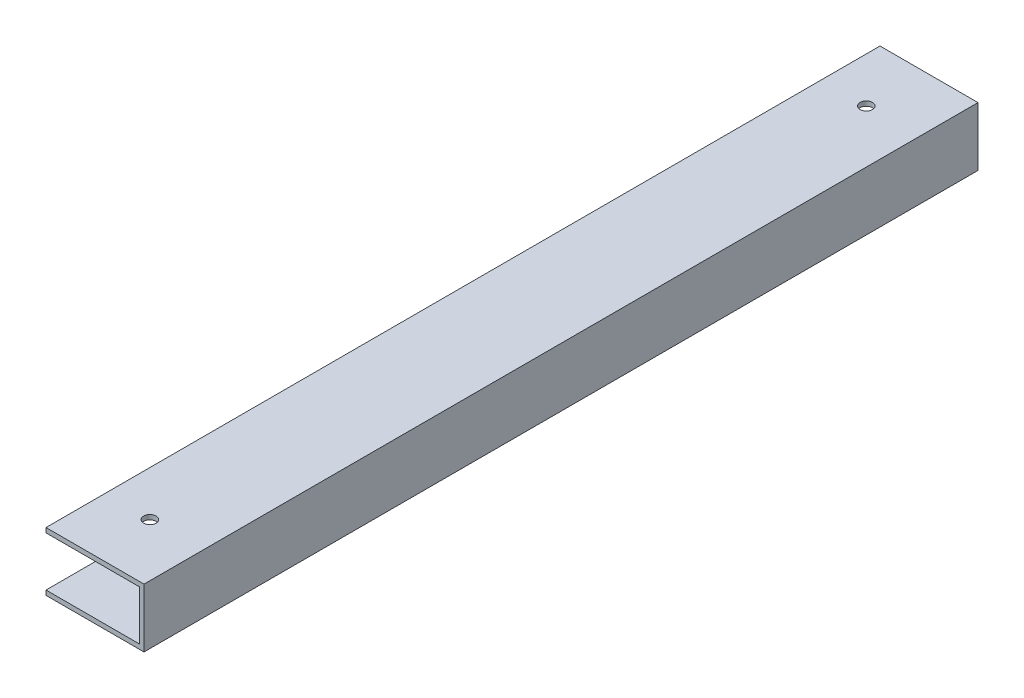
from build123d import *

# Parameters (mm, degrees)
CROQUIS2_W              = 100
CROQUIS2_H              = 60
SALIENTE_EXTRUIR1_DEPTH = 425.5
CROQUIS6_W              = 90.475
CROQUIS6_H              = 50.475
CORTAR_EXTRUIR1_DEPTH   = 900
CROQUIS7_W              = 851
CROQUIS7_H              = 50.475
CORTAR_EXTRUIR2_DEPTH   = 20
CROQUIS8_R              = 6.35
CORTAR_EXTRUIR3_DEPTH   = 80


with BuildPart() as part:
    # Croquis2 → Saliente-Extruir1 (new, symmetric)
    with BuildSketch(Plane.XY):
        Rectangle(CROQUIS2_W, CROQUIS2_H)
    extrude(amount=SALIENTE_EXTRUIR1_DEPTH, both=True)

    # Croquis6 → Cortar-Extruir1 (cut)
    with BuildSketch(Plane.XY.offset(425.5)):
        Rectangle(CROQUIS6_W, CROQUIS6_H)
    extrude(amount=-CORTAR_EXTRUIR1_DEPTH, mode=Mode.SUBTRACT)

    # Croquis7 → Cortar-Extruir2 (cut)
    with BuildSketch(Plane.ZY.offset(50)):
        Rectangle(CROQUIS7_W, CROQUIS7_H)
    extrude(amount=-CORTAR_EXTRUIR2_DEPTH, mode=Mode.SUBTRACT)

    # Croquis8 → Cortar-Extruir3 (cut)
    with BuildSketch(Plane(origin=(0, 30, 0), x_dir=(1, 0, 0), z_dir=(0, 1, 0))):
        with Locations(Location((-4, 365.5, 0), (0, 0, 180))):
            Circle(CROQUIS8_R)
        with Locations(Location((-4, -365.5, 0), (0, 0, 180))):
            Circle(CROQUIS8_R)
    extrude(amount=-CORTAR_EXTRUIR3_DEPTH, mode=Mode.SUBTRACT)


solid = part.part
